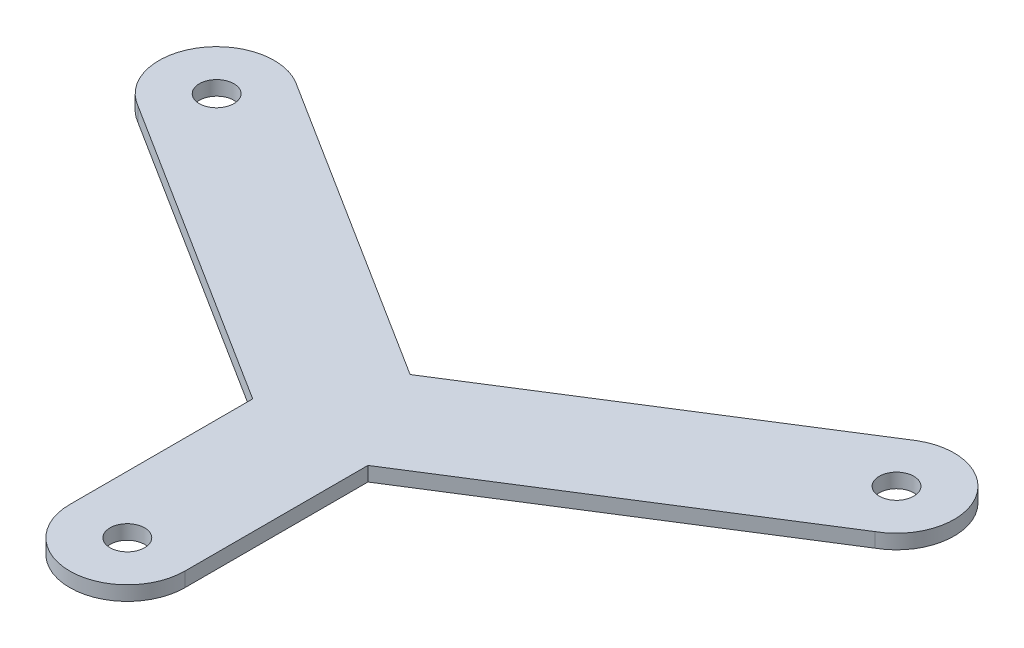
from build123d import *

# Parameters (mm, degrees)
EXTRUDE1_DEPTH = 5
EXTRUDE2_REACH = 169.33
SKETCH2_R      = 6


with BuildPart() as part:
    # Sketch1 → Extrude1 (new body)
    with BuildSketch(Plane(origin=(0, 0, 0), x_dir=(1, 0, 0), z_dir=(0, 1, 0))):
        with BuildLine():
            Line((-107.892566896, 91.758035695), (0, 23.652571955))
            Line((0, 23.652571955), (107.892566896, 91.758035695))
            ThreePointArc((107.892566896, 91.758035695), (135.320402304, 84.500183199), (127.892548484, 57.117897581))
            Line((127.892548484, 57.117897581), (19.999981588, -10.987566159))
            Line((19.999981588, -10.987566159), (19.999981588, -74.472862077))
            ThreePointArc((19.999981588, -74.472862077), (0, -94.5), (-19.999981588, -74.472862077))
            Line((-19.999981588, -74.472862077), (-19.999981588, -10.987566159))
            Line((-19.999981588, -10.987566159), (-127.892548484, 57.117897581))
            ThreePointArc((-127.892548484, 57.117897581), (-135.320402304, 84.500183199), (-107.892566896, 91.758035695))
        make_face()
    extrude(amount=EXTRUDE1_DEPTH)

    # Sketch2 → Extrude2 (cut, up to next)
    with BuildSketch(Plane(origin=(0, 5, 0), x_dir=(-1, 0, 0), z_dir=(0, 1, 0)), mode=Mode.PRIVATE) as extrude2_sk1:
        with Locations(Location((118, -74.5, 0), (0, 0, 90))):
            Circle(SKETCH2_R)
    extrude2_tool1 = extrude(extrude2_sk1.sketch, amount=-EXTRUDE2_REACH, mode=Mode.PRIVATE) & part.part
    # Sketch2 → Extrude2 (cut, up to next)
    with BuildSketch(Plane(origin=(0, 5, 0), x_dir=(-1, 0, 0), z_dir=(0, 1, 0)), mode=Mode.PRIVATE) as extrude2_sk2:
        with Locations(Location((-118, -74.5, 0), (0, 0, 90))):
            Circle(SKETCH2_R)
    extrude2_tool2 = extrude(extrude2_sk2.sketch, amount=-EXTRUDE2_REACH, mode=Mode.PRIVATE) & part.part
    # Sketch2 → Extrude2 (cut, up to next)
    with BuildSketch(Plane(origin=(0, 5, 0), x_dir=(-1, 0, 0), z_dir=(0, 1, 0)), mode=Mode.PRIVATE) as extrude2_sk3:
        with Locations(Location((0, 74.5, 0), (0, 0, 90))):
            Circle(SKETCH2_R)
    extrude2_tool3 = extrude(extrude2_sk3.sketch, amount=-EXTRUDE2_REACH, mode=Mode.PRIVATE) & part.part
    add(extrude2_tool1.solids().sort_by_distance((-118, 5, -74.5))[0], mode=Mode.SUBTRACT)
    add(extrude2_tool2.solids().sort_by_distance((118, 5, -74.5))[0], mode=Mode.SUBTRACT)
    add(extrude2_tool3.solids().sort_by_distance((0, 5, 74.5))[0], mode=Mode.SUBTRACT)


solid = part.part
